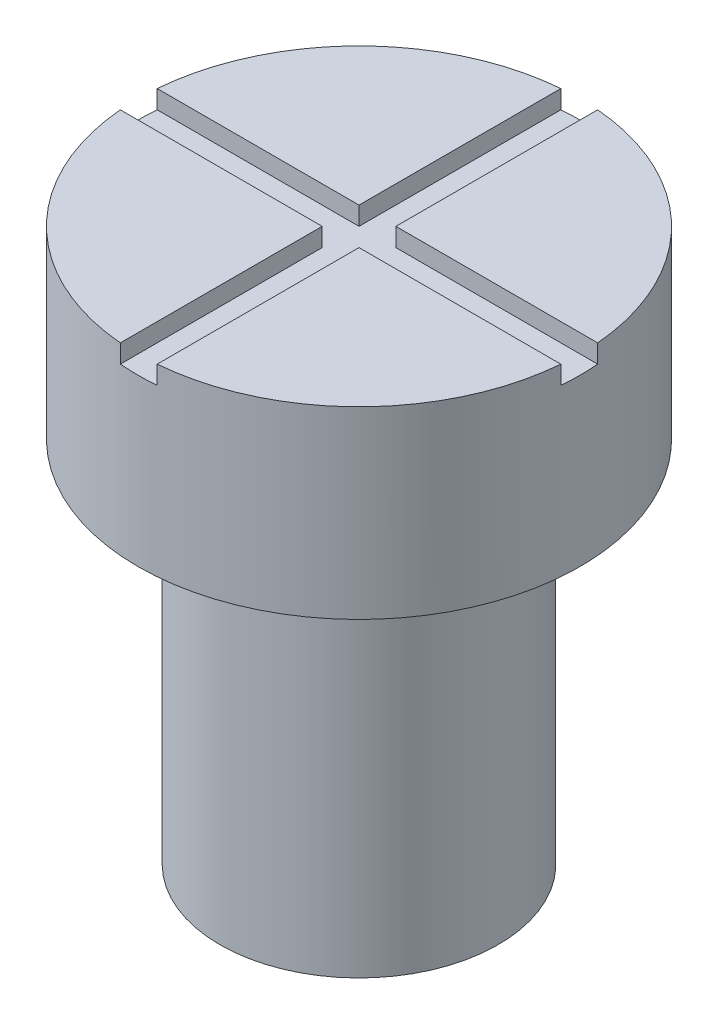
from build123d import *

# Parameters (mm, degrees)
SKETCH1_R           = 0.75565
BOSS_EXTRUDE1_DEPTH = 2
SKETCH2_R           = 1.2
BOSS_EXTRUDE2_DEPTH = 1
CUT_EXTRUDE1_START  = -0.1
CUT_EXTRUDE1_DEPTH  = 0.1


with BuildPart() as part:
    # Sketch1 → Boss-Extrude1 (new body)
    with BuildSketch(Plane(origin=(0, 0, 0), x_dir=(1, 0, 0), z_dir=(0, 1, 0))):
        with Locations(Location((-36.581586629, 71.104998538, 0), (0, 0, 270))):
            Circle(SKETCH1_R)
    extrude(amount=BOSS_EXTRUDE1_DEPTH)

    # Sketch2 → Boss-Extrude2 (add)
    with BuildSketch(Plane(origin=(0, 2, 0), x_dir=(1, 0, 0), z_dir=(0, 1, 0))):
        with Locations(Location((-36.581586629, 71.104998538, 0), (0, 0, 270))):
            Circle(SKETCH2_R)
    extrude(amount=BOSS_EXTRUDE2_DEPTH)

    # Sketch3 → Cut-Extrude1 (cut)
    with BuildSketch(Plane(origin=(0, 3, 0), x_dir=(1, 0, 0), z_dir=(0, 1, 0)).offset(CUT_EXTRUDE1_START)):
        with BuildLine():
            ThreePointArc((-36.481586629, 72.300824612), (-36.531543094, 72.303954603), (-36.581586629, 72.304998538))
            ThreePointArc((-36.581586629, 72.304998538), (-36.631630165, 72.303954603), (-36.681586629, 72.300824612))
            Line((-36.681586629, 72.300824612), (-36.681586629, 71.204998538))
            Line((-36.681586629, 71.204998538), (-37.777412704, 71.204998538))
            ThreePointArc((-37.777412704, 71.204998538), (-37.780542694, 71.155042073), (-37.781586629, 71.104998538))
            ThreePointArc((-37.781586629, 71.104998538), (-37.780542694, 71.054955003), (-37.777412704, 71.004998538))
            Line((-37.777412704, 71.004998538), (-36.681586629, 71.004998538))
            Line((-36.681586629, 71.004998538), (-36.681586629, 69.909172464))
            ThreePointArc((-36.681586629, 69.909172464), (-36.631630165, 69.906042474), (-36.581586629, 69.904998538))
            ThreePointArc((-36.581586629, 69.904998538), (-36.531543094, 69.906042474), (-36.481586629, 69.909172464))
            Line((-36.481586629, 69.909172464), (-36.481586629, 71.004998538))
            Line((-36.481586629, 71.004998538), (-35.385760555, 71.004998538))
            ThreePointArc((-35.385760555, 71.004998538), (-35.382630565, 71.054955003), (-35.381586629, 71.104998538))
            ThreePointArc((-35.381586629, 71.104998538), (-35.382630565, 71.155042073), (-35.385760555, 71.204998538))
            Line((-35.385760555, 71.204998538), (-36.481586629, 71.204998538))
            Line((-36.481586629, 71.204998538), (-36.481586629, 72.300824612))
        make_face()
    extrude(amount=CUT_EXTRUDE1_DEPTH, mode=Mode.SUBTRACT)


solid = part.part
